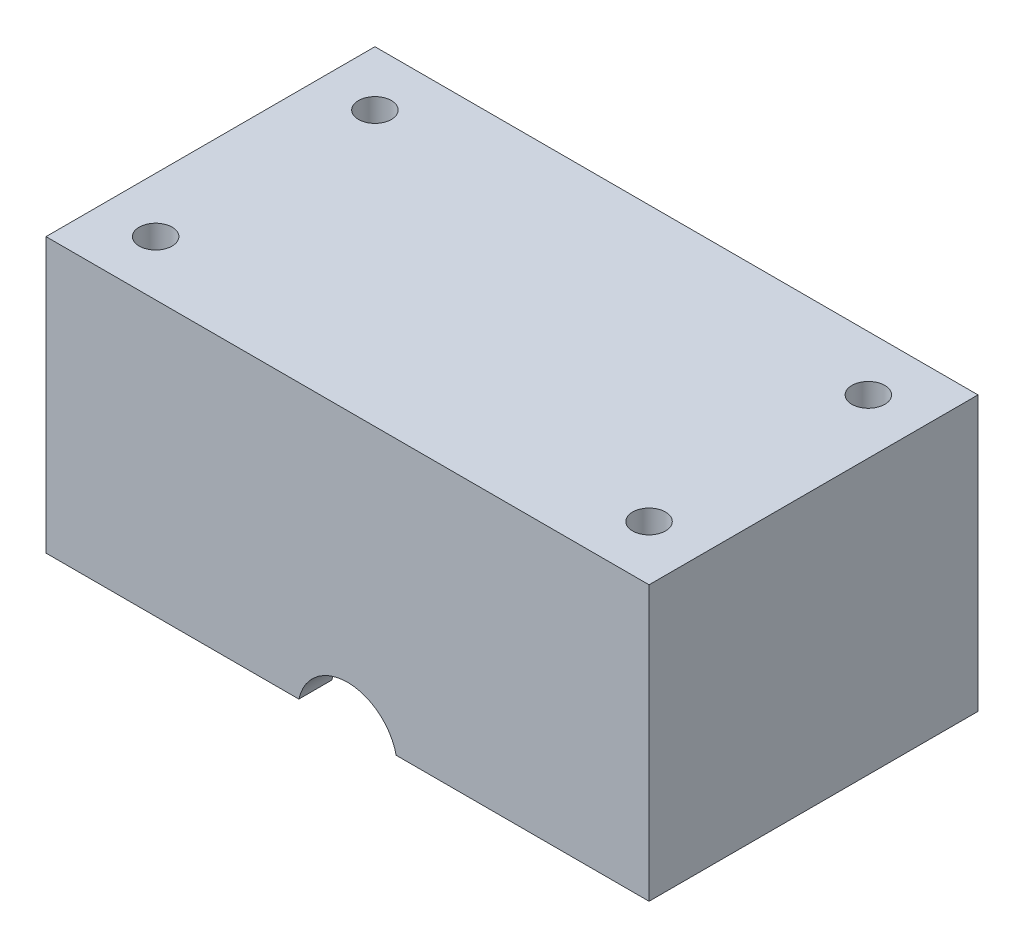
from build123d import *

# Parameters (mm, degrees)
SKETCH_2_R           = 15
EXTRUDE_1_DEPTH      = 10
EXTRUDE_START        = 10
EXTRUDE_2_DEPTH      = 10
SKETCH_4_R           = 15
EXTRUDE_3_DEPTH      = 10
SKETCH_5_R           = 4.55
CUT_EXTRUDE_1_DEPTH  = 43.804789452
SKETCH_6_R           = 1.5
CUT_EXTRUDE_2_DEPTH  = 56.213223054
SKETCH_7_R           = 15
CUT_EXTRUDE_3_DEPTH  = 13
CUT_EXTRUDE_START    = -3
SKETCH_8_R           = 15
CUT_EXTRUDE_4_DEPTH  = 3
SKETCH_10_W          = 10
SKETCH_10_H          = 30
SKETCH_10_R          = 1.5
EXTRUDE_5_DEPTH      = 45
EXTRUDE_6_REACH      = 62.467
EXTRUDE_6_END_RADIUS = 17.5
SKETCH_11_W          = 35
SKETCH_11_H          = 30
SKETCH_12_R          = 15
EXTRUDE_7_DEPTH      = 3
EXTRUDE_START_2      = -3
SKETCH_14_R          = 15
EXTRUDE_9_DEPTH      = 3
SKETCH_16_R          = 4.55
CUT_EXTRUDE_6_DEPTH  = 20
SKETCH_15_W          = 55
SKETCH_15_H          = 30
CUT_EXTRUDE_7_DEPTH  = 25


with BuildPart() as part:
    # 草图2 → 凸台-拉伸1 (new body)
    with BuildSketch(Plane.XY):
        with BuildLine():
            Line((-17.5, 21), (-17.5, 0))
            ThreePointArc((-17.5, 0), (0, -17.5), (17.5, 0))
            Line((17.5, 0), (17.5, 21))
            Line((17.5, 21), (27.5, 21))
            Line((27.5, 21), (27.5, 26))
            Line((27.5, 26), (-27.5, 26))
            Line((-27.5, 26), (-27.5, 21))
            Line((-27.5, 21), (-17.5, 21))
        make_face()
        Circle(SKETCH_2_R, mode=Mode.SUBTRACT)
    extrude(amount=EXTRUDE_1_DEPTH)

    # 草图3 → 凸台-拉伸2 (add)
    with BuildSketch(Plane(origin=(0, 0, 0), x_dir=(-1, 0, 0), z_dir=(0, 0, -1)).offset(EXTRUDE_START)):
        with BuildLine():
            Line((17.5, 0), (17.5, 21))
            Line((17.5, 21), (27.5, 21))
            Line((27.5, 21), (27.5, 26))
            Line((27.5, 26), (-27.5, 26))
            Line((-27.5, 26), (-27.5, 21))
            Line((-27.5, 21), (-17.5, 21))
            Line((-17.5, 21), (-17.5, 0))
            ThreePointArc((-17.5, 0), (0, -17.5), (17.5, 0))
        make_face()
    extrude(amount=-EXTRUDE_2_DEPTH)

    # 草图4 → 凸台-拉伸3 (add)
    with BuildSketch(Plane(origin=(0, 0, -10), x_dir=(-1, 0, 0), z_dir=(0, 0, -1)).offset(EXTRUDE_START)):
        with BuildLine():
            Line((17.5, 0), (17.5, 21))
            Line((17.5, 21), (27.5, 21))
            Line((27.5, 21), (27.5, 26))
            Line((27.5, 26), (-27.5, 26))
            Line((-27.5, 26), (-27.5, 21))
            Line((-27.5, 21), (-17.5, 21))
            Line((-17.5, 21), (-17.5, 0))
            ThreePointArc((-17.5, 0), (0, -17.5), (17.5, 0))
        make_face()
        Circle(SKETCH_4_R, mode=Mode.SUBTRACT)
    extrude(amount=-EXTRUDE_3_DEPTH)

    # 草图5 → 切除-拉伸1 (cut, through all)
    with BuildSketch(Plane.XY):
        Circle(SKETCH_5_R)
    extrude(amount=-CUT_EXTRUDE_1_DEPTH, mode=Mode.SUBTRACT)

    # 草图6 → 切除-拉伸2 (cut, through all)
    with BuildSketch(Plane(origin=(0, 26, 0), x_dir=(1, 0, 0), z_dir=(0, 1, 0))):
        with Locations((-22.5, 15)):
            Circle(SKETCH_6_R)
        with Locations((-22.5, -5)):
            Circle(SKETCH_6_R)
        with Locations((22.5, 15)):
            Circle(SKETCH_6_R)
        with Locations((22.5, -5)):
            Circle(SKETCH_6_R)
    extrude(amount=-CUT_EXTRUDE_2_DEPTH, mode=Mode.SUBTRACT)

    # 草图7 → 切除-拉伸3 (cut)
    with BuildSketch(Plane(origin=(0, 0, -20), x_dir=(-1, 0, 0), z_dir=(0, 0, -1))):
        Circle(SKETCH_7_R)
    extrude(amount=-CUT_EXTRUDE_3_DEPTH, mode=Mode.SUBTRACT)

    # 草图8 → 切除-拉伸4 (cut)
    with BuildSketch(Plane.XY.offset(CUT_EXTRUDE_START)):
        Circle(SKETCH_8_R)
    extrude(amount=CUT_EXTRUDE_4_DEPTH, mode=Mode.SUBTRACT)

    # 草图10 → 凸台-拉伸5 (add)
    # profile 1 of 2: a face of its own
    with BuildSketch(Plane.XZ.offset(-21)):
        with Locations((22.5, -5)):
            Rectangle(SKETCH_10_W, SKETCH_10_H)
        with Locations((22.5, -15)):
            Circle(SKETCH_10_R, mode=Mode.SUBTRACT)
        with Locations((22.5, 5)):
            Circle(SKETCH_10_R, mode=Mode.SUBTRACT)
    # profile 2 of 2: a face of its own
    with BuildSketch(Plane.XZ.offset(-21)):
        with Locations((-22.5, -5)):
            Rectangle(SKETCH_10_W, SKETCH_10_H)
        with Locations((-22.5, 5)):
            Circle(SKETCH_10_R, mode=Mode.SUBTRACT)
        with Locations((-22.5, -15)):
            Circle(SKETCH_10_R, mode=Mode.SUBTRACT)
    extrude(amount=EXTRUDE_5_DEPTH)

    # 凸台-拉伸6: up to this cylinder (the profile starts outside it)
    extrude_6_end = Plane(origin=(0, 0, -5), z_dir=(0, 0, -1)) * Cylinder(EXTRUDE_6_END_RADIUS, 160.934, mode=Mode.PRIVATE)
    # 草图11 → 凸台-拉伸6 (add, up to the surface)
    with BuildSketch(Plane.XZ.offset(24), mode=Mode.PRIVATE) as extrude_6_sk1:
        with Locations((0, -5)):
            Rectangle(SKETCH_11_W, SKETCH_11_H)
    extrude_6_tool1 = extrude(extrude_6_sk1.sketch, amount=-EXTRUDE_6_REACH, mode=Mode.PRIVATE) - extrude_6_end
    add(extrude_6_tool1.solids().sort_by_distance((0, -24, -5))[0])

    # 草图12 → 凸台-拉伸7 (add)
    with BuildSketch(Plane(origin=(0, 0, -20), x_dir=(-1, 0, 0), z_dir=(0, 0, -1))):
        Circle(SKETCH_12_R)
    extrude(amount=-EXTRUDE_7_DEPTH)

    # 草图14 → 凸台-拉伸9 (add)
    with BuildSketch(Plane.XY.offset(10).offset(EXTRUDE_START_2)):
        Circle(SKETCH_14_R)
    extrude(amount=EXTRUDE_9_DEPTH)

    # 草图16 → 切除-拉伸6 (cut)
    with BuildSketch(Plane.XY.offset(10)):
        Circle(SKETCH_16_R)
    extrude(amount=-CUT_EXTRUDE_6_DEPTH, mode=Mode.SUBTRACT)

    # 草图15 → 切除-拉伸7 (cut)
    with BuildSketch(Plane.XZ.offset(24)):
        with Locations((0, -5)):
            Rectangle(SKETCH_15_W, SKETCH_15_H)
    extrude(amount=-CUT_EXTRUDE_7_DEPTH, mode=Mode.SUBTRACT)


solid = part.part
